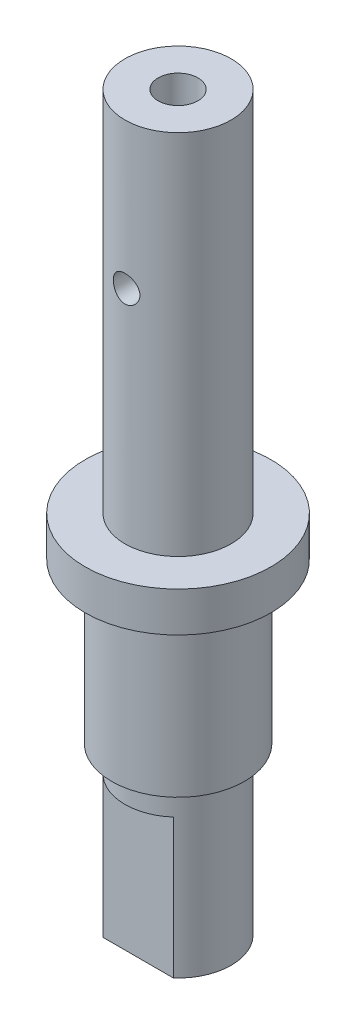
from build123d import *
from build123d.topology import SkipClean

# Parameters (mm, degrees)
SKETCH1_R                    = 4
COUPLER_SECTION_DEPTH        = 12.5
SKETCH3_R                    = 5
BEARING_SECTION_DEPTH        = 12
SKETCH4_R                    = 7
BEARING_STOP_DEPTH           = 3
SKETCH5_R                    = 4
SMALL_SEAL_SECTION_DEPTH     = 12.3
SET_SCREW_FLAT_SECTION_DEPTH = 10.5
SKETCH7_R                    = 4
IMPELLER_SECTION_DEPTH       = 15.35455
SKETCH8_R                    = 1.5
IMPELLER_BOLT_BORE_DEPTH     = 8
DOWEL_PIN_HOLE_DEPTH         = 23
DOWEL_PIN_HOLE_DEPTH_BACK    = 23
SKETCH9_R                    = 1


with BuildPart() as part:
    # Sketch1 → coupler section (new body)
    with BuildSketch(Plane(origin=(0, 0, 0), x_dir=(1, 0, 0), z_dir=(0, 1, 0))):
        with Locations(Location((0, 0, 0), (0, 0, 270))):
            Circle(SKETCH1_R)
    extrude(amount=COUPLER_SECTION_DEPTH)

    # Sketch3 → bearing section (add)
    with BuildSketch(Plane(origin=(0, 12.5, 0), x_dir=(1, 0, 0), z_dir=(0, 1, 0))):
        with Locations(Location((0, 0, 0), (0, 0, 270))):
            Circle(SKETCH3_R)
    extrude(amount=BEARING_SECTION_DEPTH)

    # Sketch4 → bearing stop (add)
    with BuildSketch(Plane(origin=(0, 24.5, 0), x_dir=(1, 0, 0), z_dir=(0, 1, 0))):
        with Locations(Location((0, 0, 0), (0, 0, 270))):
            Circle(SKETCH4_R)
    extrude(amount=BEARING_STOP_DEPTH)

    # Sketch5 → small seal section (add)
    with BuildSketch(Plane(origin=(0, 27.5, 0), x_dir=(1, 0, 0), z_dir=(0, 1, 0))):
        with Locations(Location((0, 0, 0), (0, 0, 270))):
            Circle(SKETCH5_R)
    extrude(amount=SMALL_SEAL_SECTION_DEPTH)

    # Sketch6 → set screw flat section (cut)
    with BuildSketch(Plane.XZ):
        with BuildLine():
            Line((-2.645751311, 3), (2.645751311, 3))
            ThreePointArc((2.645751311, 3), (0, 4), (-2.645751311, 3))
        make_face()
    extrude(amount=-SET_SCREW_FLAT_SECTION_DEPTH, mode=Mode.SUBTRACT)

    # Sketch7 → impeller section (add)
    with BuildSketch(Plane(origin=(0, 39.8, 0), x_dir=(1, 0, 0), z_dir=(0, 1, 0))):
        with Locations(Location((0, 0, 0), (0, 0, 311.409622109))):
            Circle(SKETCH7_R)
    extrude(amount=IMPELLER_SECTION_DEPTH)

    # Sketch8 → impeller bolt bore (cut)
    with BuildSketch(Plane(origin=(0, 55.15455, 0), x_dir=(1, 0, 0), z_dir=(0, 1, 0))):
        with Locations(Location((0, 0, 0), (0, 0, 270))):
            Circle(SKETCH8_R)
    extrude(amount=-IMPELLER_BOLT_BORE_DEPTH, mode=Mode.SUBTRACT)

    # Sketch9 → dowel pin hole (cut, two sides: drawn at the far end of the back side and taken through both)
    with SkipClean():  # the faces are left unmerged after this step: merging them gives an invalid solid
        with BuildSketch(Plane.XY.offset(-DOWEL_PIN_HOLE_DEPTH_BACK)):
            with Locations(Location((0, 44.15455, 0), (0, 0, 89.999999996))):
                Circle(SKETCH9_R)
        extrude(amount=DOWEL_PIN_HOLE_DEPTH + DOWEL_PIN_HOLE_DEPTH_BACK, mode=Mode.SUBTRACT)


solid = part.part
